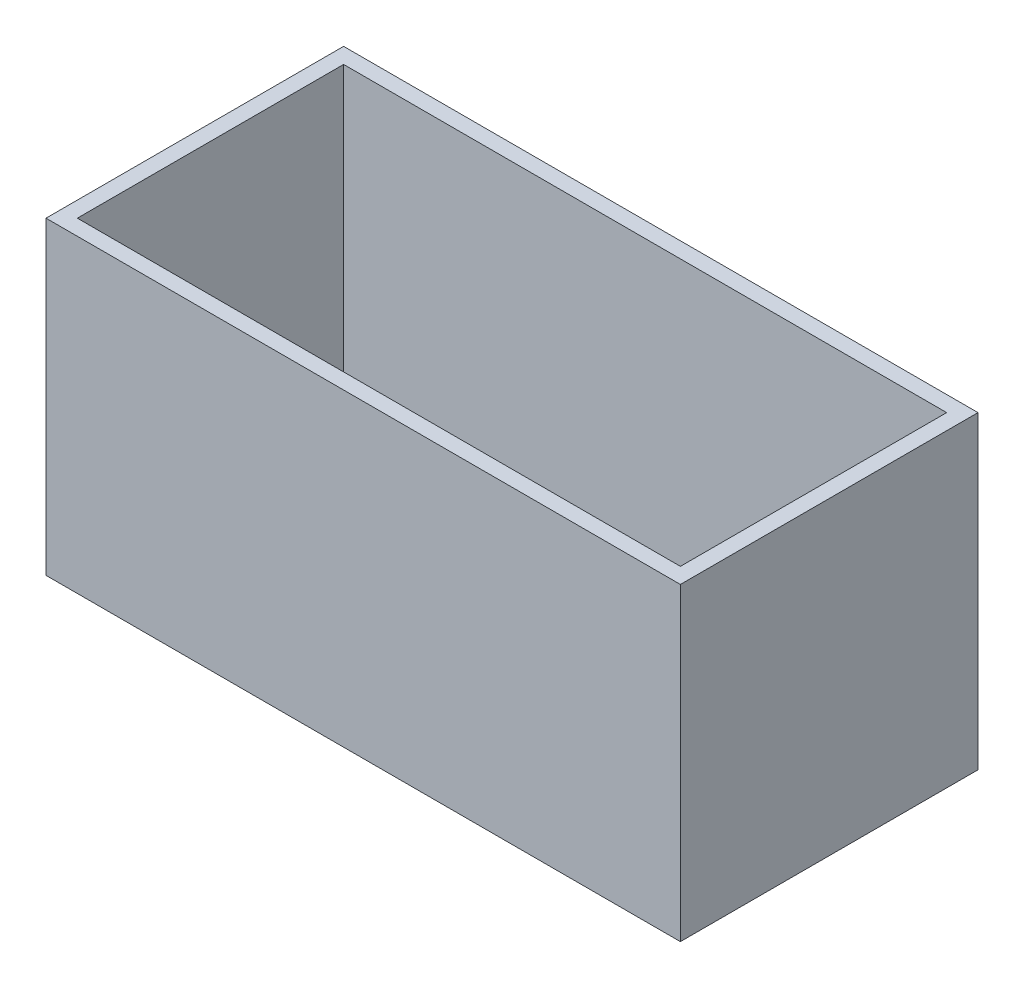
from build123d import *

# Parameters (mm, degrees)
SKETCH2_W           = 205.74
SKETCH2_H           = 96.52
BOSS_EXTRUDE1_DEPTH = 5.08
SKETCH3_W           = 205.74
SKETCH3_H           = 96.52
SKETCH3_W_2         = 195.58
SKETCH3_H_2         = 86.36
BOSS_EXTRUDE2_DEPTH = 95.25
SKETCH5_W           = 22.490008116
SKETCH5_H           = 8.285792463
CUT_EXTRUDE1_DEPTH  = 95.25


with BuildPart() as part:
    # Sketch2 → Boss-Extrude1 (new body)
    with BuildSketch(Plane(origin=(0, 0, 0), x_dir=(1, 0, 0), z_dir=(0, 1, 0))):
        Rectangle(SKETCH2_W, SKETCH2_H)
    extrude(amount=BOSS_EXTRUDE1_DEPTH)

    # Sketch3 → Boss-Extrude2 (add)
    with BuildSketch(Plane(origin=(0, 5.08, 0), x_dir=(1, 0, 0), z_dir=(0, 1, 0))):
        Rectangle(SKETCH3_W, SKETCH3_H)
        Rectangle(SKETCH3_W_2, SKETCH3_H_2, mode=Mode.SUBTRACT)
    extrude(amount=BOSS_EXTRUDE2_DEPTH)

    # Sketch5 → Cut-Extrude1 (cut)
    with BuildSketch(Plane.XZ):
        with Locations((0, 37.064125217)):
            Rectangle(SKETCH5_W, SKETCH5_H)
    extrude(amount=-CUT_EXTRUDE1_DEPTH, mode=Mode.SUBTRACT)


solid = part.part
